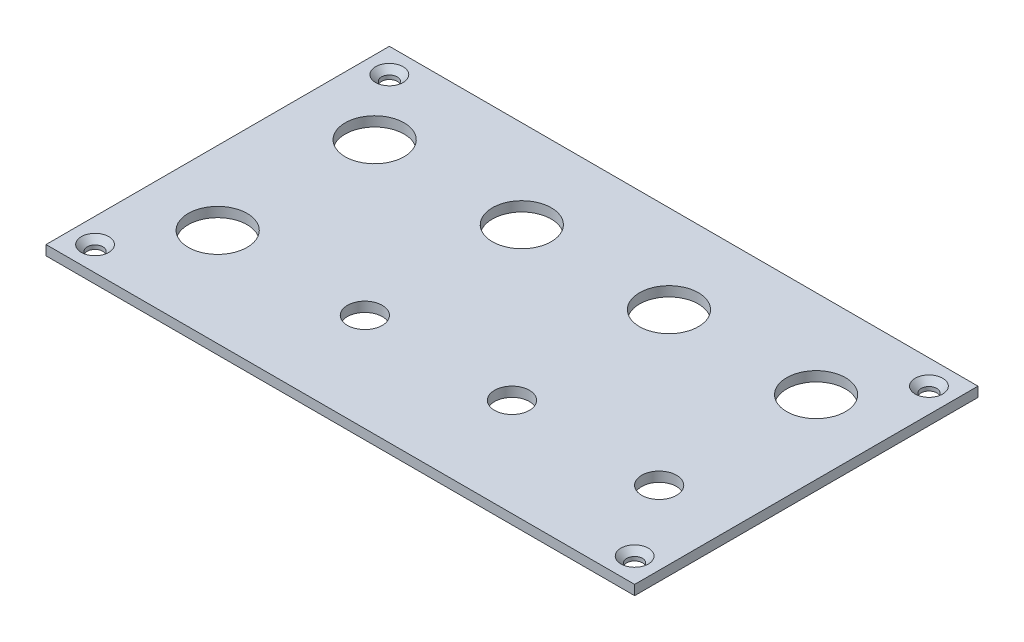
from build123d import *

# Parameters (mm, degrees)
BOTTOM_PLATE_W                       = 120
BOTTOM_PLATE_H                       = 70
BOTTOM_PLATE_EXT_DEPTH               = 2
TOP_ROW_R                            = 6
TOP_ROW_CUT_DEPTH                    = 139.938835464
BOTTOM_ROW_R                         = 3.55
BOTTOM_ROW_R_2                       = 6
BOTTOM_ROW_CUT_DEPTH                 = 139.938835464
PLATE_SCREWS_R                       = 1.6
PLATE_SCREWS_CUT_DEPTH               = 139.938835464
PLATE_SCREW_HEAD_R                   = 2.8
PLATE_SCREW_HEAD_CUT_DEPTH           = 2
PLATE_SCREW_HEAD_CUT_DRAFT           = -45
PLATE_SCREW_HEAD_CUT_PROFILE_2_DEPTH = 2
PLATE_SCREW_HEAD_CUT_PROFILE_2_DRAFT = -45
PLATE_SCREW_HEAD_CUT_PROFILE_3_DEPTH = 2
PLATE_SCREW_HEAD_CUT_PROFILE_3_DRAFT = -45
PLATE_SCREW_HEAD_CUT_PROFILE_4_DEPTH = 2
PLATE_SCREW_HEAD_CUT_PROFILE_4_DRAFT = -45


with BuildPart() as part:
    # Bottom Plate → Bottom Plate EXT (new body)
    with BuildSketch(Plane(origin=(0, 0, 0), x_dir=(1, 0, 0), z_dir=(0, 1, 0))):
        with Locations((-60, 35)):
            Rectangle(BOTTOM_PLATE_W, BOTTOM_PLATE_H)
    extrude(amount=BOTTOM_PLATE_EXT_DEPTH)

    # Top Row → Top Row Cut (cut, through all)
    with BuildSketch(Plane(origin=(0, 2, 0), x_dir=(1, 0, 0), z_dir=(0, 1, 0))):
        with Locations(Location((-105, 52, 0), (0, 0, 270))):
            Circle(TOP_ROW_R)
        with Locations(Location((-75, 52, 0), (0, 0, 270))):
            Circle(TOP_ROW_R)
        with Locations(Location((-45, 52, 0), (0, 0, 270))):
            Circle(TOP_ROW_R)
        with Locations(Location((-15, 52, 0), (0, 0, 270))):
            Circle(TOP_ROW_R)
    extrude(amount=-TOP_ROW_CUT_DEPTH, mode=Mode.SUBTRACT)

    # Bottom Row → Bottom Row Cut (cut, through all)
    with BuildSketch(Plane(origin=(0, 2, 0), x_dir=(1, 0, 0), z_dir=(0, 1, 0))):
        with Locations(Location((-75, 20, 0), (0, 0, 270))):
            Circle(BOTTOM_ROW_R)
        with Locations(Location((-45, 20, 0), (0, 0, 270))):
            Circle(BOTTOM_ROW_R)
        with Locations(Location((-15, 20, 0), (0, 0, 270))):
            Circle(BOTTOM_ROW_R)
        with Locations(Location((-105, 20, 0), (0, 0, 270))):
            Circle(BOTTOM_ROW_R_2)
    extrude(amount=-BOTTOM_ROW_CUT_DEPTH, mode=Mode.SUBTRACT)

    # Plate Screws → Plate Screws Cut (cut, through all)
    with BuildSketch(Plane(origin=(0, 2, 0), x_dir=(1, 0, 0), z_dir=(0, 1, 0))):
        with Locations(Location((-115, 65, 0), (0, 0, 270))):
            Circle(PLATE_SCREWS_R)
        with Locations(Location((-5, 65, 0), (0, 0, 270))):
            Circle(PLATE_SCREWS_R)
        with Locations(Location((-5, 5, 0), (0, 0, 270))):
            Circle(PLATE_SCREWS_R)
        with Locations(Location((-115, 5, 0), (0, 0, 270))):
            Circle(PLATE_SCREWS_R)
    extrude(amount=-PLATE_SCREWS_CUT_DEPTH, mode=Mode.SUBTRACT)


with BuildPart() as plate_screw_head_cut_tool:
    # Plate Screw Head → Plate Screw Head Cut (with draft: the straight prism first)
    with BuildSketch(Plane(origin=(0, 2, 0), x_dir=(1, 0, 0), z_dir=(0, 1, 0))):
        with Locations((-115, 65)):
            Circle(PLATE_SCREW_HEAD_R)
    extrude(amount=-PLATE_SCREW_HEAD_CUT_DEPTH)
    # Plate Screw Head Cut: the draft: its side faces are tilted about the plane it starts from
    plate_screw_head_cut_sides = [plate_screw_head_cut_tool.faces().sort_by_distance(p)[0] for p in [
        (-117.8, 1, -65),
    ]]
    draft(plate_screw_head_cut_sides, Plane(origin=(0, 2, 0), x_dir=(1, 0, 0), z_dir=(0, 1, 0)), PLATE_SCREW_HEAD_CUT_DRAFT)


with BuildPart() as part_1:
    add(part.part)

    # Plate Screw Head Cut: cut by plate_screw_head_cut_tool
    add(plate_screw_head_cut_tool.part, mode=Mode.SUBTRACT)


with BuildPart() as plate_screw_head_cut_profile_2_tool:
    # Plate Screw Head → Plate Screw Head Cut profile 2 (with draft: the straight prism first)
    with BuildSketch(Plane(origin=(0, 2, 0), x_dir=(1, 0, 0), z_dir=(0, 1, 0))):
        with Locations((-5, 65)):
            Circle(PLATE_SCREW_HEAD_R)
    extrude(amount=-PLATE_SCREW_HEAD_CUT_PROFILE_2_DEPTH)
    # Plate Screw Head Cut profile 2: the draft: its side faces are tilted about the plane it starts from
    plate_screw_head_cut_profile_2_sides = [plate_screw_head_cut_profile_2_tool.faces().sort_by_distance(p)[0] for p in [
        (-7.8, 1, -65),
    ]]
    draft(plate_screw_head_cut_profile_2_sides, Plane(origin=(0, 2, 0), x_dir=(1, 0, 0), z_dir=(0, 1, 0)), PLATE_SCREW_HEAD_CUT_PROFILE_2_DRAFT)


with BuildPart() as part_2:
    add(part_1.part)

    # Plate Screw Head Cut profile 2: cut by plate_screw_head_cut_profile_2_tool
    add(plate_screw_head_cut_profile_2_tool.part, mode=Mode.SUBTRACT)


with BuildPart() as plate_screw_head_cut_profile_3_tool:
    # Plate Screw Head → Plate Screw Head Cut profile 3 (with draft: the straight prism first)
    with BuildSketch(Plane(origin=(0, 2, 0), x_dir=(1, 0, 0), z_dir=(0, 1, 0))):
        with Locations((-5, 5)):
            Circle(PLATE_SCREW_HEAD_R)
    extrude(amount=-PLATE_SCREW_HEAD_CUT_PROFILE_3_DEPTH)
    # Plate Screw Head Cut profile 3: the draft: its side faces are tilted about the plane it starts from
    plate_screw_head_cut_profile_3_sides = [plate_screw_head_cut_profile_3_tool.faces().sort_by_distance(p)[0] for p in [
        (-7.8, 1, -5),
    ]]
    draft(plate_screw_head_cut_profile_3_sides, Plane(origin=(0, 2, 0), x_dir=(1, 0, 0), z_dir=(0, 1, 0)), PLATE_SCREW_HEAD_CUT_PROFILE_3_DRAFT)


with BuildPart() as part_3:
    add(part_2.part)

    # Plate Screw Head Cut profile 3: cut by plate_screw_head_cut_profile_3_tool
    add(plate_screw_head_cut_profile_3_tool.part, mode=Mode.SUBTRACT)


with BuildPart() as plate_screw_head_cut_profile_4_tool:
    # Plate Screw Head → Plate Screw Head Cut profile 4 (with draft: the straight prism first)
    with BuildSketch(Plane(origin=(0, 2, 0), x_dir=(1, 0, 0), z_dir=(0, 1, 0))):
        with Locations((-115, 5)):
            Circle(PLATE_SCREW_HEAD_R)
    extrude(amount=-PLATE_SCREW_HEAD_CUT_PROFILE_4_DEPTH)
    # Plate Screw Head Cut profile 4: the draft: its side faces are tilted about the plane it starts from
    plate_screw_head_cut_profile_4_sides = [plate_screw_head_cut_profile_4_tool.faces().sort_by_distance(p)[0] for p in [
        (-117.8, 1, -5),
    ]]
    draft(plate_screw_head_cut_profile_4_sides, Plane(origin=(0, 2, 0), x_dir=(1, 0, 0), z_dir=(0, 1, 0)), PLATE_SCREW_HEAD_CUT_PROFILE_4_DRAFT)


with BuildPart() as part_4:
    add(part_3.part)

    # Plate Screw Head Cut profile 4: cut by plate_screw_head_cut_profile_4_tool
    add(plate_screw_head_cut_profile_4_tool.part, mode=Mode.SUBTRACT)


solid = part_4.part
